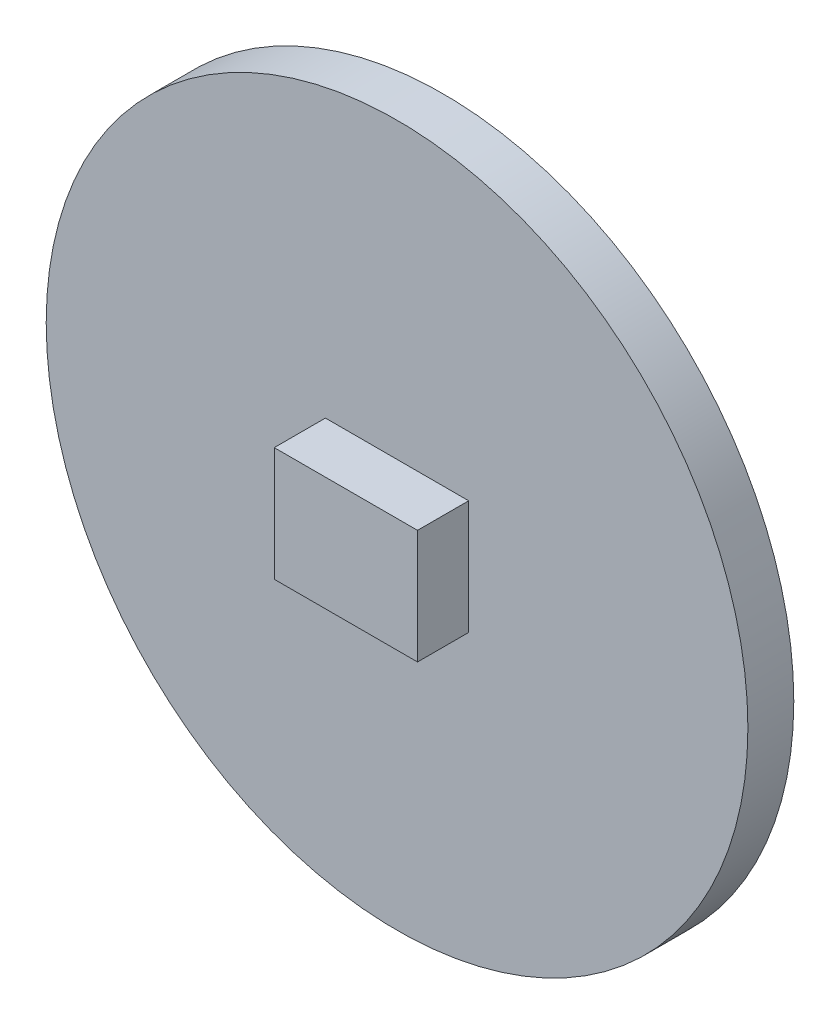
from build123d import *

# Parameters (mm, degrees)
SKETCH1_R           = 12
BOSS_EXTRUDE1_DEPTH = 1.57
SKETCH2_W           = 4.9
SKETCH2_H           = 3.9
BOSS_EXTRUDE2_DEPTH = 1.75


with BuildPart() as part:
    # Sketch1 → Boss-Extrude1 (new body)
    with BuildSketch(Plane.XY):
        Circle(SKETCH1_R)
    extrude(amount=BOSS_EXTRUDE1_DEPTH)

    # Sketch2 → Boss-Extrude2 (add)
    with BuildSketch(Plane.XY.offset(1.57)):
        Rectangle(SKETCH2_W, SKETCH2_H)
    extrude(amount=BOSS_EXTRUDE2_DEPTH)


solid = part.part
